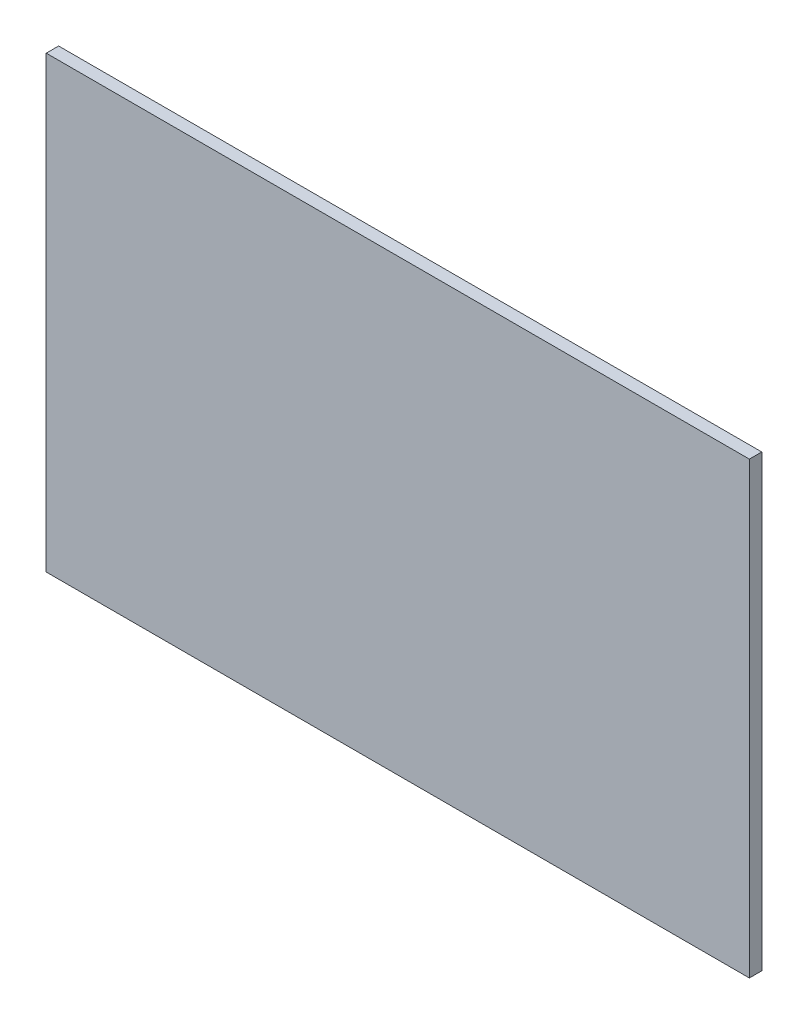
from build123d import *

# Parameters (mm, degrees)
SKETCH1_W           = 144.021664816
SKETCH1_H           = 92.046104328
BOSS_EXTRUDE1_DEPTH = 2.54


with BuildPart() as part:
    # Sketch1 → Boss-Extrude1 (new body)
    with BuildSketch(Plane.XY):
        Rectangle(SKETCH1_W, SKETCH1_H)
    extrude(amount=BOSS_EXTRUDE1_DEPTH)


solid = part.part
